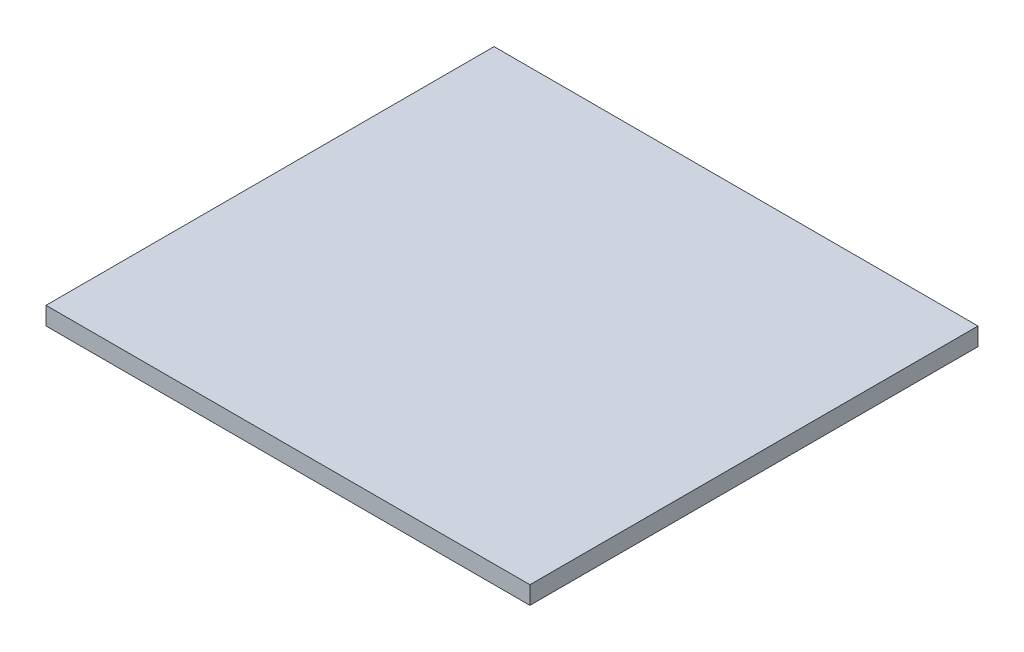
from build123d import *

# Parameters (mm, degrees)
SKETCH1_W           = 54
SKETCH1_H           = 50
BOSS_EXTRUDE1_DEPTH = 2


with BuildPart() as part:
    # Sketch1 → Boss-Extrude1 (new body)
    with BuildSketch(Plane(origin=(0, 0, 0), x_dir=(1, 0, 0), z_dir=(0, 1, 0))):
        with Locations((27, 25)):
            Rectangle(SKETCH1_W, SKETCH1_H)
    extrude(amount=BOSS_EXTRUDE1_DEPTH)


solid = part.part
